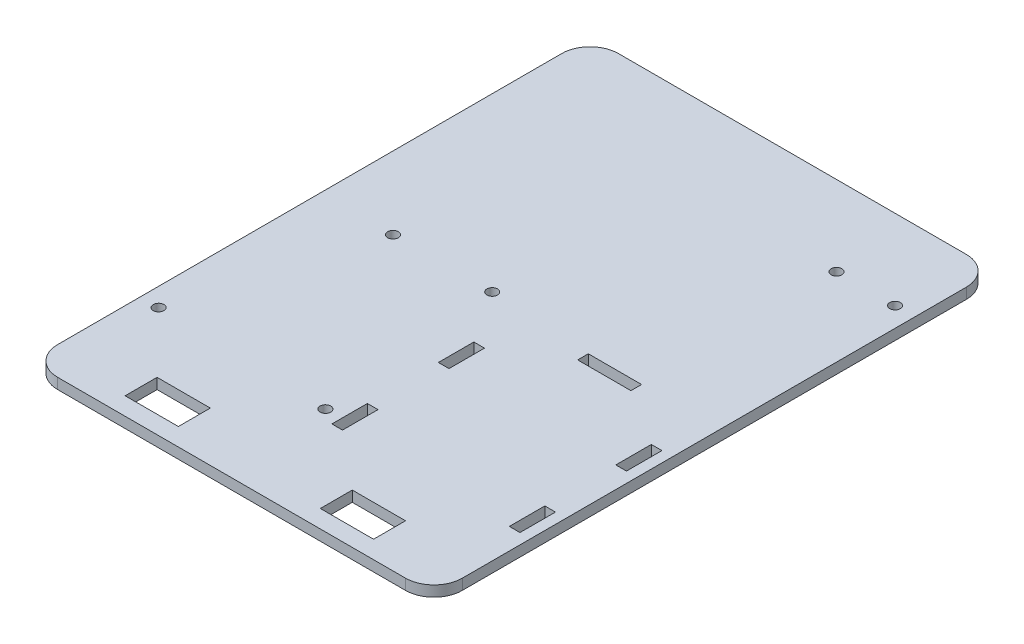
from build123d import *

# Parameters (mm, degrees)
BOSS_EXTRUDE1_DEPTH = 3
SKETCH2_R           = 1.5
CUT_EXTRUDE1_DEPTH  = 98.462813421
SKETCH3_W           = 15
SKETCH3_H           = 9
SKETCH3_W_2         = 3
SKETCH3_H_2         = 10
SKETCH3_H_3         = 3
CUT_EXTRUDE2_DEPTH  = 98.462813421


with BuildPart() as part:
    # Sketch1 → Boss-Extrude1 (new body)
    with BuildSketch(Plane(origin=(0, 0, 0), x_dir=(1, 0, 0), z_dir=(0, 1, 0))):
        with BuildLine():
            Line((-49, 79), (49, 79))
            ThreePointArc((49, 79), (54.656854249, 76.656854249), (57, 71))
            Line((57, 71), (57, -71))
            ThreePointArc((57, -71), (54.656854249, -76.656854249), (49, -79))
            Line((49, -79), (-49, -79))
            ThreePointArc((-49, -79), (-54.656854249, -76.656854249), (-57, -71))
            Line((-57, -71), (-57, 71))
            ThreePointArc((-57, 71), (-54.656854249, 76.656854249), (-49, 79))
        make_face()
    extrude(amount=BOSS_EXTRUDE1_DEPTH)

    # Sketch2 → Cut-Extrude1 (cut, through all)
    with BuildSketch(Plane(origin=(0, 3, 0), x_dir=(1, 0, 0), z_dir=(0, 1, 0))):
        with Locations(Location((-36.56, 3.04, 0), (0, 0, 270))):
            Circle(SKETCH2_R)
        with Locations(Location((-8.62, 3.04, 0), (0, 0, 270))):
            Circle(SKETCH2_R)
        with Locations(Location((-51.8, -47.76, 0), (0, 0, 270))):
            Circle(SKETCH2_R)
        with Locations(Location((-3.54, -49.03, 0), (0, 0, 270))):
            Circle(SKETCH2_R)
        with Locations(Location((34.95, 56.46, 0), (0, 0, 270))):
            Circle(SKETCH2_R)
        with Locations(Location((51.46, 56.46, 0), (0, 0, 270))):
            Circle(SKETCH2_R)
    extrude(amount=-CUT_EXTRUDE1_DEPTH, mode=Mode.SUBTRACT)

    # Sketch3 → Cut-Extrude2 (cut, through all)
    with BuildSketch(Plane(origin=(0, 0, 0), x_dir=(-1, 0, 0), z_dir=(0, -1, 0))):
        with Locations((27.5, -69.5)):
            Rectangle(SKETCH3_W, SKETCH3_H)
        with Locations((-27.5, -69.5)):
            Rectangle(SKETCH3_W, SKETCH3_H)
        with Locations((-2.5, -46.75)):
            Rectangle(SKETCH3_W_2, SKETCH3_H_2)
        with Locations((-2.5, -16.75)):
            Rectangle(SKETCH3_W_2, SKETCH3_H_2)
        with Locations((-27.5, 0)):
            Rectangle(SKETCH3_W, SKETCH3_H_3)
        with Locations((-52.5, -16.75)):
            Rectangle(SKETCH3_W_2, SKETCH3_H_2)
        with Locations((-52.5, -46.75)):
            Rectangle(SKETCH3_W_2, SKETCH3_H_2)
    extrude(amount=-CUT_EXTRUDE2_DEPTH, mode=Mode.SUBTRACT)


solid = part.part
